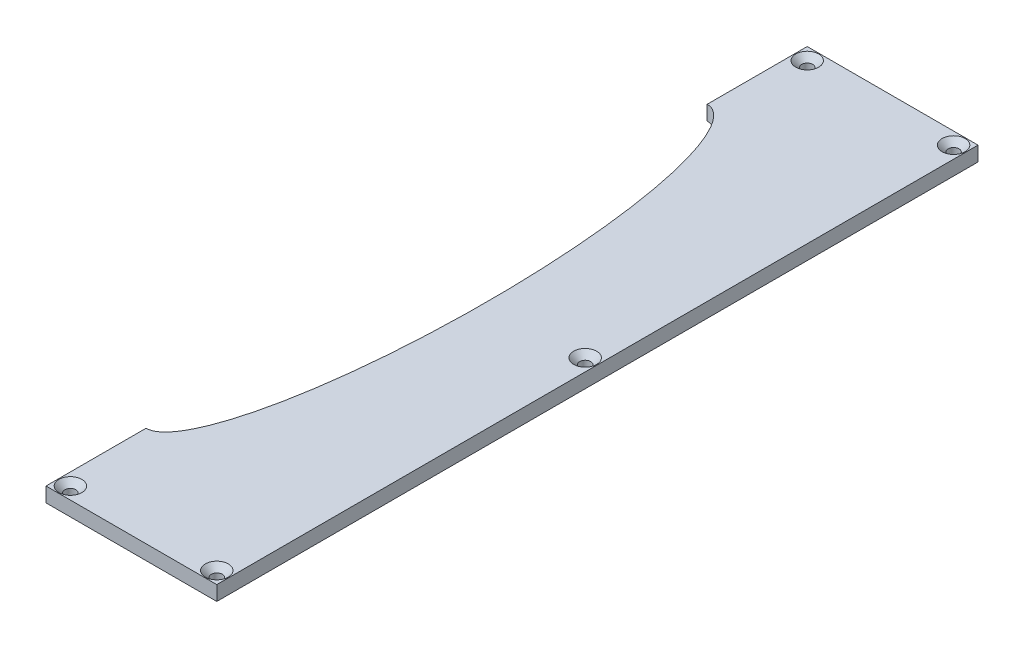
from build123d import *

# Parameters (mm, degrees)
BOSS_EXTRUDE1_DEPTH                                 = 6
CSK_FOR_M4_COUNTERSUNK_FLAT_HEAD_SCREW1_D           = 4.5
CSK_FOR_M4_COUNTERSUNK_FLAT_HEAD_SCREW1_DEPTH       = 10
CSK_FOR_M4_COUNTERSUNK_FLAT_HEAD_SCREW1_CSINK_D     = 9.4
CSK_FOR_M4_COUNTERSUNK_FLAT_HEAD_SCREW1_CSINK_ANGLE = 90
CSK_FOR_M4_COUNTERSUNK_FLAT_HEAD_SCREW1_TIP         = 1.351936393


with BuildPart() as part:
    # Sketch1 → Boss-Extrude1 (new body)
    with BuildSketch(Plane(origin=(0, 0, 0), x_dir=(1, 0, 0), z_dir=(0, 1, 0))):
        with BuildLine():
            Line((0, 156), (0, 115))
            add(Edge.make_bspline(
                [(0, -115), (25, -115), (25, 0), (25, 115), (0, 115)],
                knots=[3.141592654, 3.141592654, 3.141592654, 4.71238898, 4.71238898, 6.283185307, 6.283185307, 6.283185307], degree=2, weights=[1, 0.707106781, 1, 0.707106781, 1]))
            Line((0, -115), (0, -156))
            Line((0, -156), (70, -156))
            Line((70, -156), (70, 156))
            Line((70, 156), (0, 156))
        make_face()
    extrude(amount=BOSS_EXTRUDE1_DEPTH)

    # CSK for M4 Countersunk Flat Head Screw1
    with Locations(Plane(origin=(0, 6, 0), x_dir=(1, 0, 0), z_dir=(0, 1, 0))):
        with Locations((5, 151), (65, 151), (65, 0), (65, -151), (5, -151)):
            CounterSinkHole(CSK_FOR_M4_COUNTERSUNK_FLAT_HEAD_SCREW1_D / 2, CSK_FOR_M4_COUNTERSUNK_FLAT_HEAD_SCREW1_CSINK_D / 2, depth=CSK_FOR_M4_COUNTERSUNK_FLAT_HEAD_SCREW1_DEPTH, counter_sink_angle=CSK_FOR_M4_COUNTERSUNK_FLAT_HEAD_SCREW1_CSINK_ANGLE)
            with Locations((0, 0, -(CSK_FOR_M4_COUNTERSUNK_FLAT_HEAD_SCREW1_DEPTH + CSK_FOR_M4_COUNTERSUNK_FLAT_HEAD_SCREW1_TIP / 2))):  # 118° drill point
                Cone(0, CSK_FOR_M4_COUNTERSUNK_FLAT_HEAD_SCREW1_D / 2, CSK_FOR_M4_COUNTERSUNK_FLAT_HEAD_SCREW1_TIP, mode=Mode.SUBTRACT)


solid = part.part
